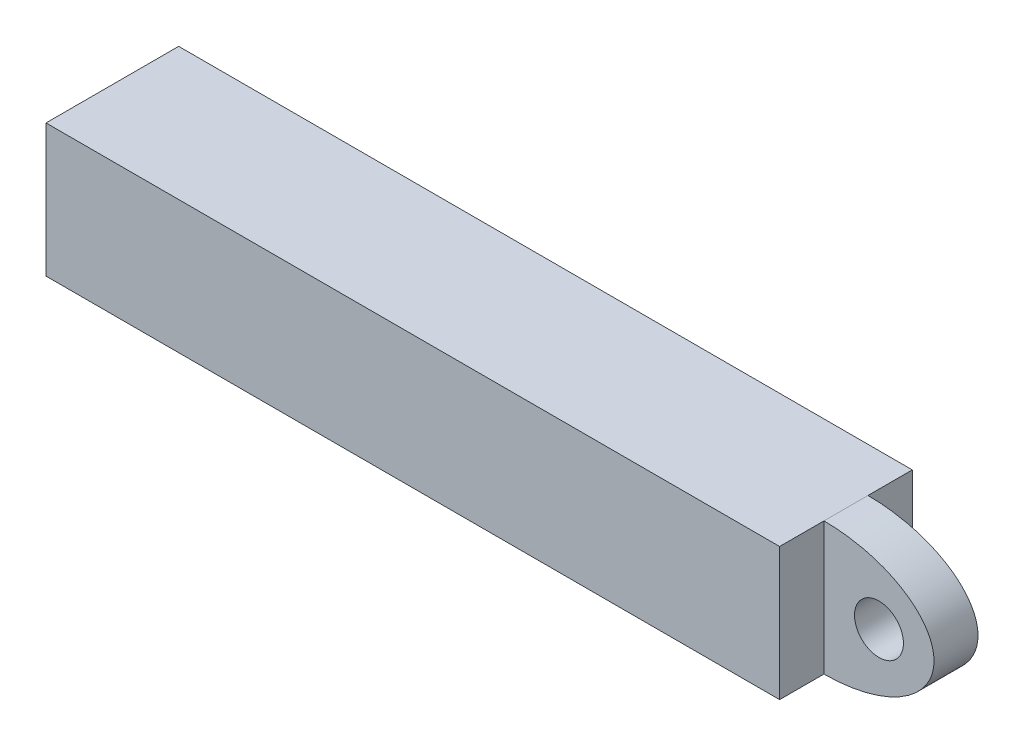
from build123d import *

# Parameters (mm, degrees)
SKETCH1_W           = 68.9
SKETCH1_H           = 68.9
BOSS_EXTRUDE1_DEPTH = 381
SKETCH2_R           = 12.7
BOSS_EXTRUDE2_DEPTH = 11.43


with BuildPart() as part:
    # Sketch1 → Boss-Extrude1 (new body)
    with BuildSketch(Plane(origin=(0, 0, 0), x_dir=(0, 0, -1), z_dir=(1, 0, 0))):
        Rectangle(SKETCH1_W, SKETCH1_H)
    extrude(amount=BOSS_EXTRUDE1_DEPTH)

    # Sketch2 → Boss-Extrude2 (add, symmetric)
    with BuildSketch(Plane.XY):
        with BuildLine():
            Line((381, 34.45), (381, -34.45))
            add(Edge.make_bspline(
                [(381, -34.45), (438.15, -34.45), (438.15, 0), (438.15, 34.45), (381, 34.45)],
                knots=[4.71238898, 4.71238898, 4.71238898, 6.283185307, 6.283185307, 7.853981634, 7.853981634, 7.853981634], degree=2, weights=[1, 0.707106781, 1, 0.707106781, 1]))
        make_face()
        with Locations((409.575, 0)):
            Circle(SKETCH2_R, mode=Mode.SUBTRACT)
    extrude(amount=BOSS_EXTRUDE2_DEPTH, both=True)


solid = part.part
